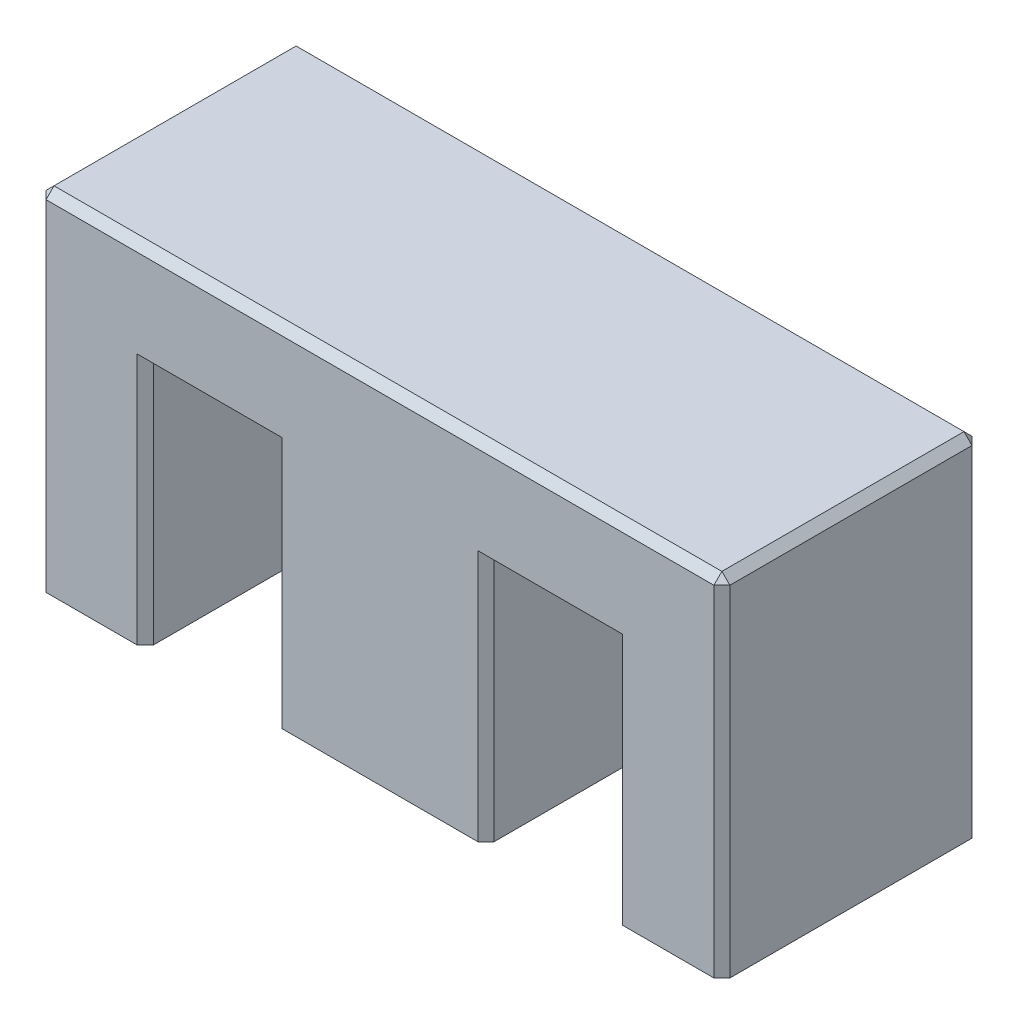
from build123d import *

# Parameters (mm, degrees)
BOSS_EXTRUDE1_DEPTH = 16.125
CHAMFER1_SIZE       = 1


with BuildPart() as part:
    # Sketch1 → Boss-Extrude1 (new, symmetric)
    with BuildSketch(Plane.XY):
        Polygon((13.25, -21.75), (-13.25, -21.75), (-13.25, 8.75), (-29.325, 8.75), (-29.325, -21.75), (-42.725, -21.75), (-42.725, 21.75), (42.725, 21.75), (42.725, -21.75), (29.325, -21.75), (29.325, 8.75), (13.25, 8.75), align=None)
    extrude(amount=BOSS_EXTRUDE1_DEPTH, both=True)

    # Chamfer1
    chamfer1_edges = [part.edges().sort_by_distance(p)[0] for p in [
        (13.25, -6.5, -16.125),
        (-13.25, -6.5, -16.125),
        (-21.2875, 8.75, -16.125),
        (-29.325, -6.5, -16.125),
        (-42.725, 0, -16.125),
        (0, 21.75, -16.125),
        (42.725, 0, -16.125),
        (29.325, -6.5, -16.125),
        (21.2875, 8.75, -16.125),
        (42.725, 0, 16.125),
        (0, 21.75, 16.125),
        (-42.725, 21.75, 0),
        (42.725, 21.75, 0),
        (-42.725, 0, 16.125),
        (-29.325, -6.5, 16.125),
        (-21.2875, 8.75, 16.125),
        (-13.25, -6.5, 16.125),
        (13.25, -6.5, 16.125),
        (21.2875, 8.75, 16.125),
        (29.325, -6.5, 16.125),
    ]]
    chamfer(chamfer1_edges, length=CHAMFER1_SIZE)


solid = part.part
